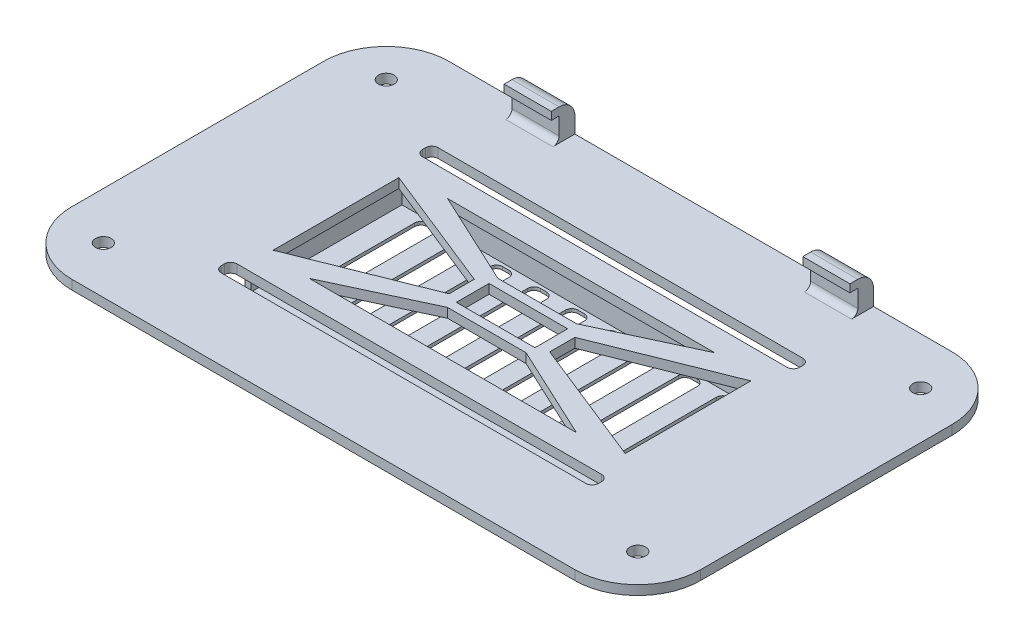
from build123d import *

# Parameters (mm, degrees)
SKETCH1_W               = 200
SKETCH1_H               = 120
BOSS_EXTRUDE1_DEPTH     = 3
SKETCH2_W               = 120
SKETCH2_H               = 50
BOSS_EXTRUDE2_DEPTH     = 8
SKETCH3_W               = 116
SKETCH3_H               = 1
SKETCH3_H_2             = 6
CUT_EXTRUDE2_DEPTH      = 48
SKETCH4_W               = 25
SKETCH4_H               = 10.416666666
CUT_EXTRUDE3_DEPTH      = 4
CUT_EXTRUDE4_DEPTH      = 4
FILLET1_R               = 20
SKETCH6_W               = 15
SKETCH6_H               = 7.5
BOSS_EXTRUDE3_DEPTH     = 10
SKETCH7_W               = 2.5
SKETCH7_H               = 7.5
CUT_EXTRUDE5_DEPTH      = 17
FILLET4_R               = 2
FILLET5_R               = 5
CUT_EXTRUDE6_DEPTH      = 10
FILLET4_OF_MIRROR3_R    = 2
FILLET5_OF_MIRROR3_R    = 5
SKETCH10_R              = 2.5
CUT_EXTRUDE7_DEPTH      = 15
MIRROR5_COPY_1_SKETCH_R = 2.5
MIRROR5_COPY_1_DEPTH    = 15


with BuildPart() as part:
    # Sketch1 → Boss-Extrude1 (new body)
    with BuildSketch(Plane(origin=(0, 0, 0), x_dir=(1, 0, 0), z_dir=(0, 1, 0))):
        Rectangle(SKETCH1_W, SKETCH1_H)
    extrude(amount=BOSS_EXTRUDE1_DEPTH)

    # Sketch2 → Boss-Extrude2 (add)
    with BuildSketch(Plane.XZ):
        Rectangle(SKETCH2_W, SKETCH2_H)
    extrude(amount=BOSS_EXTRUDE2_DEPTH)

    # Sketch3 → Cut-Extrude2 (cut)
    with BuildSketch(Plane.XY.offset(25)):
        with Locations((0, -0.5)):
            Rectangle(SKETCH3_W, SKETCH3_H)
        with Locations((0, -4)):
            Rectangle(SKETCH3_W, SKETCH3_H_2)
    extrude(amount=-CUT_EXTRUDE2_DEPTH, mode=Mode.SUBTRACT)

    # Sketch4 → Cut-Extrude3 (cut)
    with BuildSketch(Plane(origin=(0, 3, 0), x_dir=(1, 0, 0), z_dir=(0, 1, 0))):
        Polygon((12.5, -8), (42.5, -22), (-42.5, -22), (-12.5, -8), align=None)
        Polygon((56, 20), (56, -20), (16, -4), (16, 4), align=None)
        Polygon((-12.5, 8), (12.5, 8), (42.5, 22), (-42.5, 22), align=None)
        Rectangle(SKETCH4_W, SKETCH4_H)
        Polygon((-16, -4), (-16, 0), (-56, 0), (-56, -20), align=None)
        Polygon((-16, 0), (-16, 4), (-56, 20), (-56, 0), align=None)
    extrude(amount=-CUT_EXTRUDE3_DEPTH, mode=Mode.SUBTRACT)

    # Sketch5 → Cut-Extrude4 (cut)
    with BuildSketch(Plane.XZ.offset(8)):
        with BuildLine():
            Line((9, 20), (9, -20))
            ThreePointArc((9, -20), (9.585786438, -21.414213562), (11, -22))
            Line((11, -22), (13, -22))
            ThreePointArc((13, -22), (14.414213562, -21.414213562), (15, -20))
            Line((15, -20), (15, 20))
            ThreePointArc((15, 20), (14.414213562, 21.414213562), (13, 22))
            Line((13, 22), (11, 22))
            ThreePointArc((11, 22), (9.585786438, 21.414213562), (9, 20))
        make_face()
        with BuildLine():
            Line((-1, 22), (1, 22))
            ThreePointArc((1, 22), (2.414213562, 21.414213562), (3, 20))
            Line((3, 20), (3, -20))
            ThreePointArc((3, -20), (2.414213562, -21.414213562), (1, -22))
            Line((1, -22), (-1, -22))
            ThreePointArc((-1, -22), (-2.414213562, -21.414213562), (-3, -20))
            Line((-3, -20), (-3, 20))
            ThreePointArc((-3, 20), (-2.414213562, 21.414213562), (-1, 22))
        make_face()
        with BuildLine():
            Line((21, 20), (21, -20))
            ThreePointArc((21, -20), (21.585786438, -21.414213562), (23, -22))
            Line((23, -22), (25, -22))
            ThreePointArc((25, -22), (26.414213562, -21.414213562), (27, -20))
            Line((27, -20), (27, 20))
            ThreePointArc((27, 20), (26.414213562, 21.414213562), (25, 22))
            Line((25, 22), (23, 22))
            ThreePointArc((23, 22), (21.585786438, 21.414213562), (21, 20))
        make_face()
        with BuildLine():
            Line((33, 20), (33, -20))
            ThreePointArc((33, -20), (33.585786438, -21.414213562), (35, -22))
            Line((35, -22), (37, -22))
            ThreePointArc((37, -22), (38.414213562, -21.414213562), (39, -20))
            Line((39, -20), (39, 20))
            ThreePointArc((39, 20), (38.414213562, 21.414213562), (37, 22))
            Line((37, 22), (35, 22))
            ThreePointArc((35, 22), (33.585786438, 21.414213562), (33, 20))
        make_face()
        with BuildLine():
            Line((45, 20), (45, -20))
            ThreePointArc((45, -20), (45.585786438, -21.414213562), (47, -22))
            Line((47, -22), (49, -22))
            ThreePointArc((49, -22), (50.414213562, -21.414213562), (51, -20))
            Line((51, -20), (51, 20))
            ThreePointArc((51, 20), (50.414213562, 21.414213562), (49, 22))
            Line((49, 22), (47, 22))
            ThreePointArc((47, 22), (45.585786438, 21.414213562), (45, 20))
        make_face()
        with BuildLine():
            Line((-15, 20), (-15, -20))
            ThreePointArc((-15, -20), (-14.414213562, -21.414213562), (-13, -22))
            Line((-13, -22), (-11, -22))
            ThreePointArc((-11, -22), (-9.585786438, -21.414213562), (-9, -20))
            Line((-9, -20), (-9, 20))
            ThreePointArc((-9, 20), (-9.585786438, 21.414213562), (-11, 22))
            Line((-11, 22), (-13, 22))
            ThreePointArc((-13, 22), (-14.414213562, 21.414213562), (-15, 20))
        make_face()
        with BuildLine():
            Line((-27, 20), (-27, -20))
            ThreePointArc((-27, -20), (-26.414213562, -21.414213562), (-25, -22))
            Line((-25, -22), (-23, -22))
            ThreePointArc((-23, -22), (-21.585786438, -21.414213562), (-21, -20))
            Line((-21, -20), (-21, 20))
            ThreePointArc((-21, 20), (-21.585786438, 21.414213562), (-23, 22))
            Line((-23, 22), (-25, 22))
            ThreePointArc((-25, 22), (-26.414213562, 21.414213562), (-27, 20))
        make_face()
        with BuildLine():
            Line((-39, 20), (-39, -20))
            ThreePointArc((-39, -20), (-38.414213562, -21.414213562), (-37, -22))
            Line((-37, -22), (-35, -22))
            ThreePointArc((-35, -22), (-33.585786438, -21.414213562), (-33, -20))
            Line((-33, -20), (-33, 20))
            ThreePointArc((-33, 20), (-33.585786438, 21.414213562), (-35, 22))
            Line((-35, 22), (-37, 22))
            ThreePointArc((-37, 22), (-38.414213562, 21.414213562), (-39, 20))
        make_face()
        with BuildLine():
            Line((-51, 20), (-51, -20))
            ThreePointArc((-51, -20), (-50.414213562, -21.414213562), (-49, -22))
            Line((-49, -22), (-47, -22))
            ThreePointArc((-47, -22), (-45.585786438, -21.414213562), (-45, -20))
            Line((-45, -20), (-45, 20))
            ThreePointArc((-45, 20), (-45.585786438, 21.414213562), (-47, 22))
            Line((-47, 22), (-49, 22))
            ThreePointArc((-49, 22), (-50.414213562, 21.414213562), (-51, 20))
        make_face()
    extrude(amount=-CUT_EXTRUDE4_DEPTH, mode=Mode.SUBTRACT)

    # Fillet1
    fillet1_edges = [part.edges().sort_by_distance(p)[0] for p in [
        (100, 1.5, 60),
        (-100, 1.5, 60),
        (-100, 1.5, -60),
        (100, 1.5, -60),
    ]]
    fillet(fillet1_edges, radius=FILLET1_R)

    # Sketch6 → Boss-Extrude3 (add)
    with BuildSketch(Plane(origin=(0, 3, 0), x_dir=(1, 0, 0), z_dir=(0, 1, 0))):
        with Locations((-47.5, 56.25)):
            Rectangle(SKETCH6_W, SKETCH6_H)
    boss_extrude3 = extrude(amount=BOSS_EXTRUDE3_DEPTH)

    # Sketch7 → Cut-Extrude5 (cut)
    with BuildSketch(Plane.ZY.offset(55)):
        with Locations((-53.75, 6.75)):
            Rectangle(SKETCH7_W, SKETCH7_H)
    cut_extrude5 = extrude(amount=-CUT_EXTRUDE5_DEPTH, mode=Mode.SUBTRACT)

    # Fillet4
    fillet4_edges = [part.edges().sort_by_distance(p)[0] for p in [
        (-47.5, 3, -55),
    ]]
    fillet(fillet4_edges, radius=FILLET4_R)

    # Fillet5
    fillet5_edges = [part.edges().sort_by_distance(p)[0] for p in [
        (-47.5, 13, -60),
    ]]
    fillet(fillet5_edges, radius=FILLET5_R)

    # Sketch8 → Cut-Extrude6 (cut)
    with BuildSketch(Plane(origin=(0, 3, 0), x_dir=(1, 0, 0), z_dir=(0, 1, 0))):
        with BuildLine():
            Line((-58, 34.5), (58, 34.5))
            ThreePointArc((58, 34.5), (59.414213562, 33.914213562), (60, 32.5))
            Line((60, 32.5), (60, 31.5))
            ThreePointArc((60, 31.5), (59.414213562, 30.085786438), (58, 29.5))
            Line((58, 29.5), (-58, 29.5))
            ThreePointArc((-58, 29.5), (-59.414213562, 30.085786438), (-60, 31.5))
            Line((-60, 31.5), (-60, 32.5))
            ThreePointArc((-60, 32.5), (-59.414213562, 33.914213562), (-58, 34.5))
        make_face()
    cut_extrude6 = extrude(amount=-CUT_EXTRUDE6_DEPTH, mode=Mode.SUBTRACT)

    # Mirror1: Cut-Extrude6 across plane
    add(cut_extrude6.mirror(Plane.XY), mode=Mode.SUBTRACT)

    # Mirror3: Boss-Extrude3, Cut-Extrude5 across plane
    add(boss_extrude3.mirror(Plane(origin=(0, 0, 0), x_dir=(0, 0, 1), z_dir=(1, 0, 0))))
    add(cut_extrude5.mirror(Plane(origin=(0, 0, 0), x_dir=(0, 0, 1), z_dir=(1, 0, 0))), mode=Mode.SUBTRACT)

    # Fillet4 of Mirror3
    fillet4_of_mirror3_edges = [part.edges().sort_by_distance(p)[0] for p in [
        (47.5, 3, -55),
    ]]
    fillet(fillet4_of_mirror3_edges, radius=FILLET4_OF_MIRROR3_R)

    # Fillet5 of Mirror3
    fillet5_of_mirror3_edges = [part.edges().sort_by_distance(p)[0] for p in [
        (47.5, 13, -60),
    ]]
    fillet(fillet5_of_mirror3_edges, radius=FILLET5_OF_MIRROR3_R)

    # Sketch10 → Cut-Extrude7 (cut)
    with BuildSketch(Plane(origin=(0, 3, 0), x_dir=(1, 0, 0), z_dir=(0, 1, 0))):
        with Locations(Location((85, -45, 0), (0, 0, 270))):
            Circle(SKETCH10_R)
    cut_extrude7 = extrude(amount=-CUT_EXTRUDE7_DEPTH, mode=Mode.SUBTRACT)

    # Mirror4: Cut-Extrude7 across plane
    add(cut_extrude7.mirror(Plane(origin=(0, 0, 0), x_dir=(0, 0, 1), z_dir=(1, 0, 0))), mode=Mode.SUBTRACT)

    # Mirror5: Cut-Extrude7 across plane
    add(cut_extrude7.mirror(Plane.XY), mode=Mode.SUBTRACT)

    # Mirror5 copy 1 sketch → Mirror5 copy 1 (cut)
    with BuildSketch(Plane(origin=(0, 3, 0), x_dir=(-1, 0, 0), z_dir=(0, 1, 0))):
        with Locations(Location((85, -45, 0), (0, 0, 270))):
            Circle(MIRROR5_COPY_1_SKETCH_R)
    extrude(amount=-MIRROR5_COPY_1_DEPTH, mode=Mode.SUBTRACT)


solid = part.part
